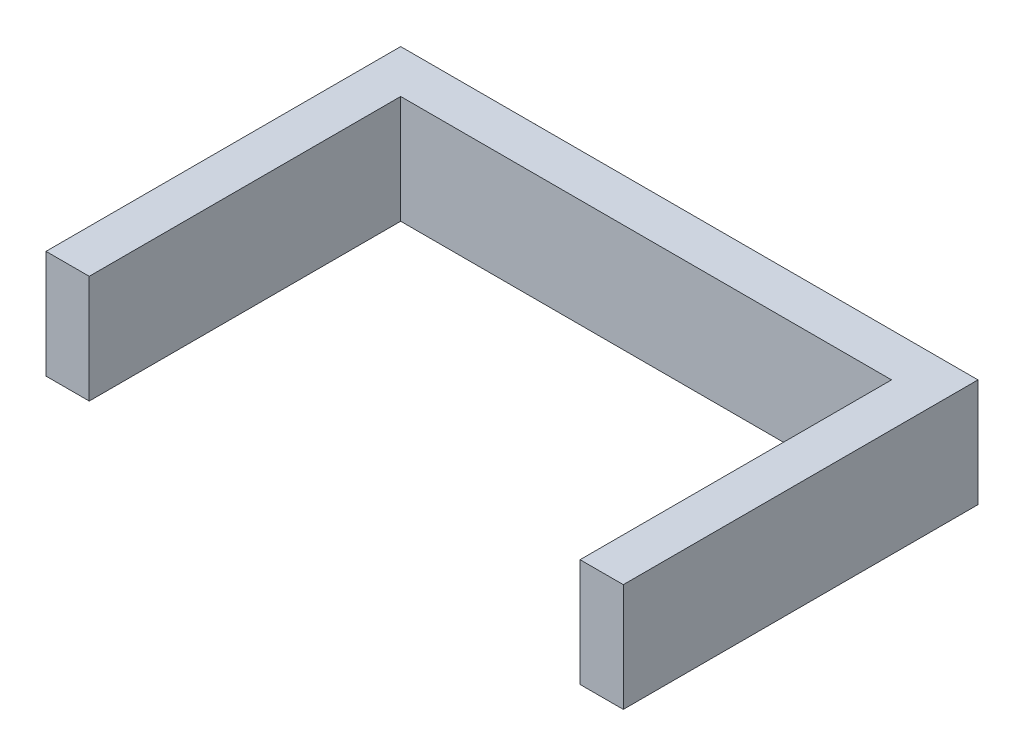
from build123d import *

# Parameters (mm, degrees)
BOSS_EXTRUDE1_DEPTH = 5


with BuildPart() as part:
    # Sketch2 → Boss-Extrude1 (new body)
    with BuildSketch(Plane(origin=(0, 0, 0), x_dir=(1, 0, 0), z_dir=(0, 1, 0))):
        Polygon((-2, 0), (-2, 16.41), (24.71, 16.41), (24.71, 0), (22.71, 0), (22.71, 14.41), (0, 14.41), (0, 0), align=None)
    extrude(amount=BOSS_EXTRUDE1_DEPTH)


solid = part.part
